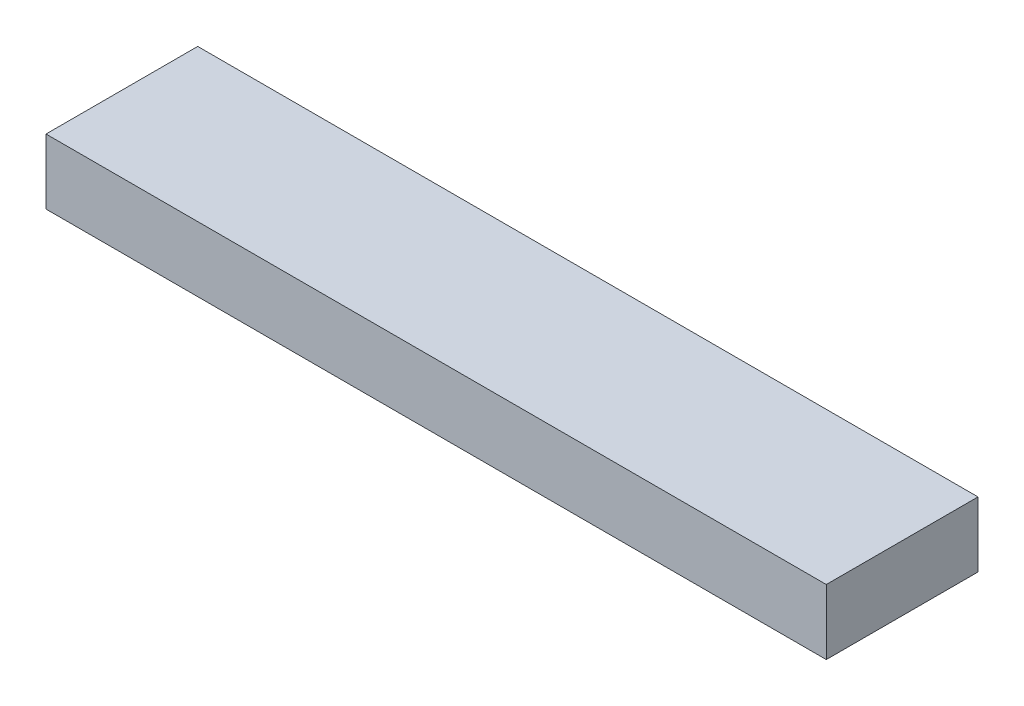
from build123d import *

# Parameters (mm, degrees)
SKETCH1_W           = 457.2
SKETCH1_H           = 88.9
BOSS_EXTRUDE1_DEPTH = 38.1


with BuildPart() as part:
    # Sketch1 → Boss-Extrude1 (new body)
    with BuildSketch(Plane(origin=(0, 0, 0), x_dir=(1, 0, 0), z_dir=(0, 1, 0))):
        with Locations((172.139982616, -33.982693406)):
            Rectangle(SKETCH1_W, SKETCH1_H)
    extrude(amount=BOSS_EXTRUDE1_DEPTH)


solid = part.part
